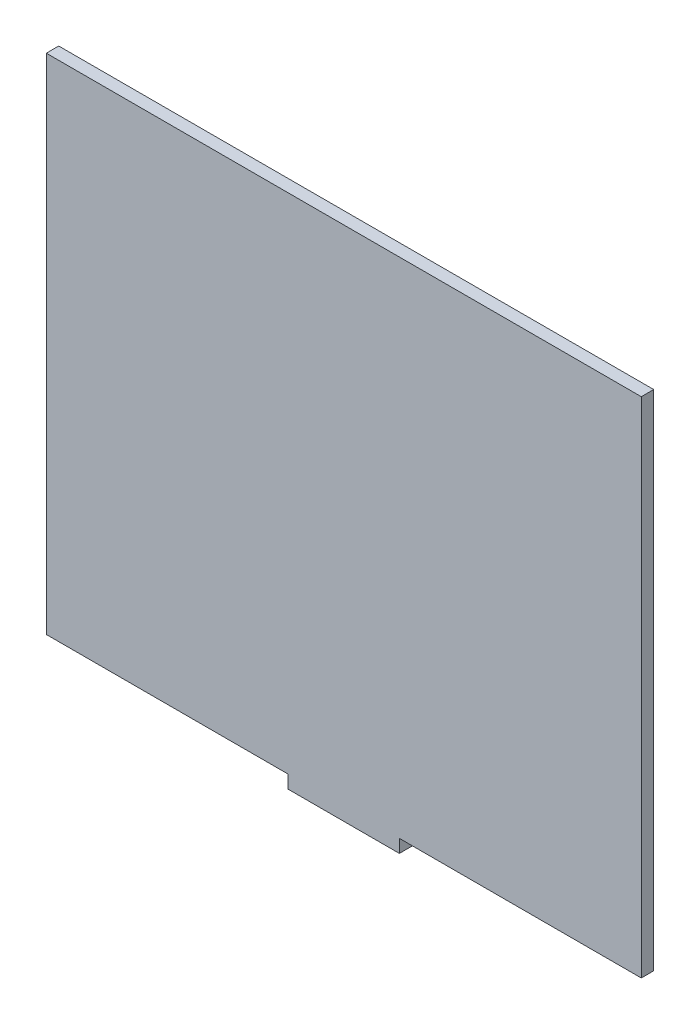
from build123d import *

# Parameters (mm, degrees)
SKETCH_1_W      = 91
SKETCH_1_H      = 77
SKETCH_1_W_2    = 17
SKETCH_1_H_2    = 2
EXTRUDE_1_DEPTH = 1.9


with BuildPart() as part:
    # 草图1 → 凸台-拉伸1 (new body)
    with BuildSketch(Plane.XY):
        Rectangle(SKETCH_1_W, SKETCH_1_H)
        with Locations((0, -39.5)):
            Rectangle(SKETCH_1_W_2, SKETCH_1_H_2)
    extrude(amount=EXTRUDE_1_DEPTH)


solid = part.part
